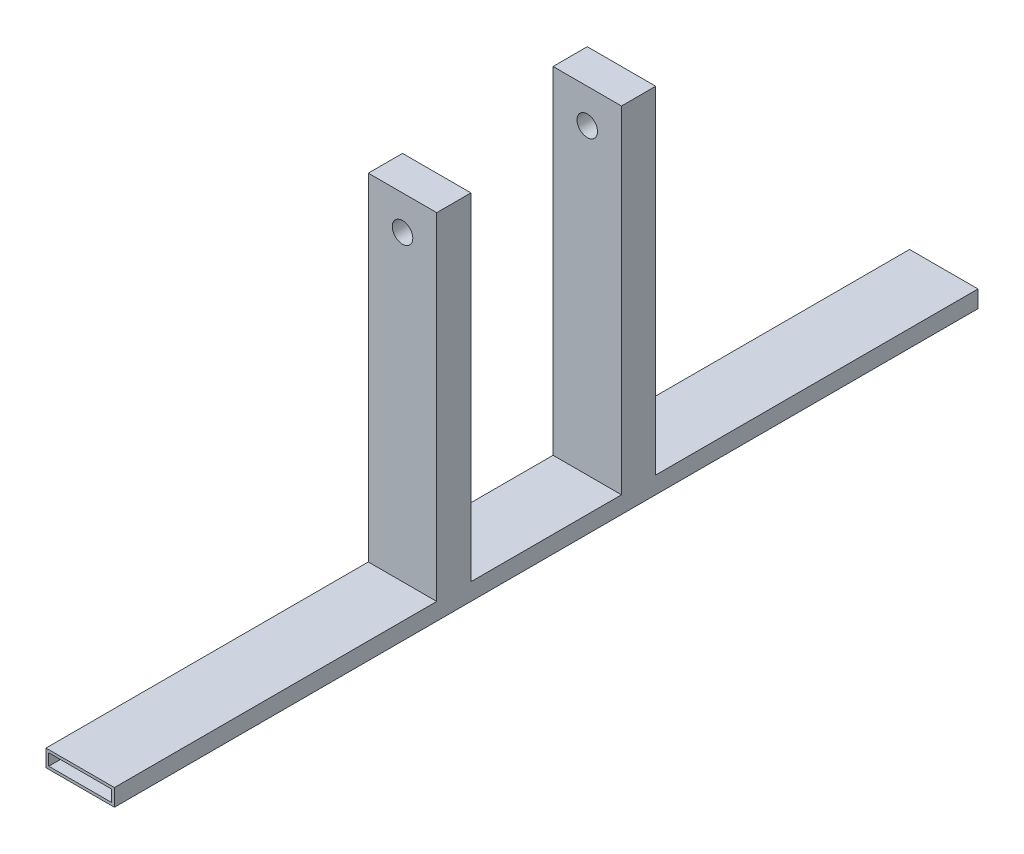
from build123d import *

# Parameters (mm, degrees)
SKETCH1_W               = 50
SKETCH1_H               = 12.499999892
BOSS_EXTRUDE1_DEPTH     = 631
SHELL1_T                = -2
SKETCH3_W               = 50
SKETCH3_H               = 25
BOSS_EXTRUDE2_DEPTH     = 250
CUT_EXTRUDE1_DEPTH      = 470.079458784
CUT_EXTRUDE1_DEPTH_BACK = 470.079458784
SKETCH4_R               = 7.5


with BuildPart() as part:
    # Sketch1 → Boss-Extrude1 (new body)
    with BuildSketch(Plane.XY):
        with Locations((8.395937674, -2.291666613)):
            Rectangle(SKETCH1_W, SKETCH1_H)
    extrude(amount=BOSS_EXTRUDE1_DEPTH)

    # Shell1
    shell1_openings = [part.faces().sort_by_distance(p)[0] for p in [
        (8.395937674, -2.291666613, 631),
        (8.395937674, -2.291666613, 0),
    ]]
    offset(amount=SHELL1_T, openings=shell1_openings, kind=Kind.INTERSECTION)

    # Sketch3 → Boss-Extrude2 (add)
    with BuildSketch(Plane(origin=(0, 0, 0), x_dir=(1, 0, 0), z_dir=(0, 1, 0))):
        with Locations((8.395937674, -248)):
            Rectangle(SKETCH3_W, SKETCH3_H)
        with Locations((8.395937674, -383)):
            Rectangle(SKETCH3_W, SKETCH3_H)
    extrude(amount=BOSS_EXTRUDE2_DEPTH)

    # Sketch4 → Cut-Extrude1 (cut, two sides: drawn at the far end of the back side and taken through both)
    with BuildSketch(Plane(origin=(0, 0, 235.5), x_dir=(-1, 0, 0), z_dir=(0, 0, -1)).offset(-CUT_EXTRUDE1_DEPTH_BACK)):
        with Locations((-8.395937674, 225)):
            Circle(SKETCH4_R)
    extrude(amount=CUT_EXTRUDE1_DEPTH + CUT_EXTRUDE1_DEPTH_BACK, mode=Mode.SUBTRACT)


solid = part.part
